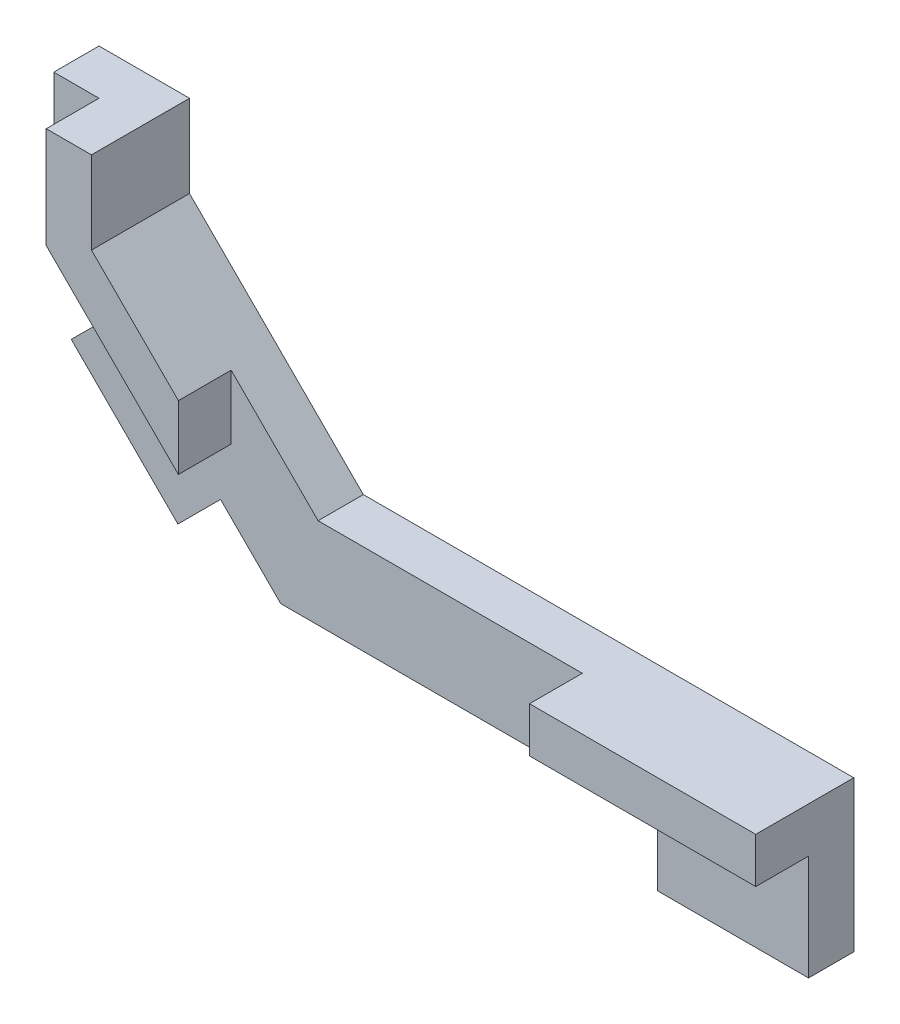
from build123d import *

# Parameters (mm, degrees)
SKETCH1_W                = 35
SKETCH1_H                = 3
BOSS_EXTRUDE1_DEPTH      = 6
BOSS_EXTRUDE2_DEPTH      = 3
BOSS_EXTRUDE3_DEPTH      = 3.5
BOSS_EXTRUDE3_DEPTH_BACK = 3
SKETCH3_W                = 15
SKETCH3_H                = 3
SKETCH4_W                = 10
SKETCH4_H                = 3
BOSS_EXTRUDE4_DEPTH      = 4
SKETCH5_W                = 3
SKETCH5_H                = 10
BOSS_EXTRUDE5_DEPTH      = 4


with BuildPart() as part:
    # Sketch1 → Boss-Extrude1 (new body)
    with BuildSketch(Plane(origin=(0, 0, 0), x_dir=(1, 0, 0), z_dir=(0, 1, 0))):
        Rectangle(SKETCH1_W, SKETCH1_H)
    extrude(amount=BOSS_EXTRUDE1_DEPTH)

    # Sketch2 → Boss-Extrude2 (add)
    with BuildSketch(Plane.XY.offset(1.5)):
        Polygon((-17.5, 0), (-32.547232304, 15.047232304), (-32.547232304, 22.997232304), (-26.547232304, 22.997232304), (-26.547232304, 17.527232304), (-15.02, 6), (-17.5, 6), align=None)
    extrude(amount=-BOSS_EXTRUDE2_DEPTH)

    # Sketch3 → Boss-Extrude3 (add, two sides: drawn at the far end of the back side and taken through both)
    with BuildSketch(Plane.XY.offset(1.5).offset(-BOSS_EXTRUDE3_DEPTH_BACK)):
        Polygon((-29.547232304, 22.997232304), (-26.547232304, 22.997232304), (-26.547232304, 17.527232304), (-20.783616152, 11.763616152), (-20.783616152, 7.520975465), (-29.547232304, 16.284591617), align=None)
        with Locations((10, 4.5)):
            Rectangle(SKETCH3_W, SKETCH3_H)
    extrude(amount=BOSS_EXTRUDE3_DEPTH + BOSS_EXTRUDE3_DEPTH_BACK)

    # Sketch4 → Boss-Extrude4 (add)
    with BuildSketch(Plane.XZ):
        with Locations((12.5, 0)):
            Rectangle(SKETCH4_W, SKETCH4_H)
    extrude(amount=BOSS_EXTRUDE4_DEPTH)

    # Sketch5 → Boss-Extrude5 (add)
    with BuildSketch(Plane(origin=(-8.75, -8.75, 0), x_dir=(0, 0, 1), z_dir=(-0.7071067811865436, -0.7071067811865515, 0))):
        with Locations((0, 23.014368671)):
            Rectangle(SKETCH5_W, SKETCH5_H)
    extrude(amount=BOSS_EXTRUDE5_DEPTH)


solid = part.part
